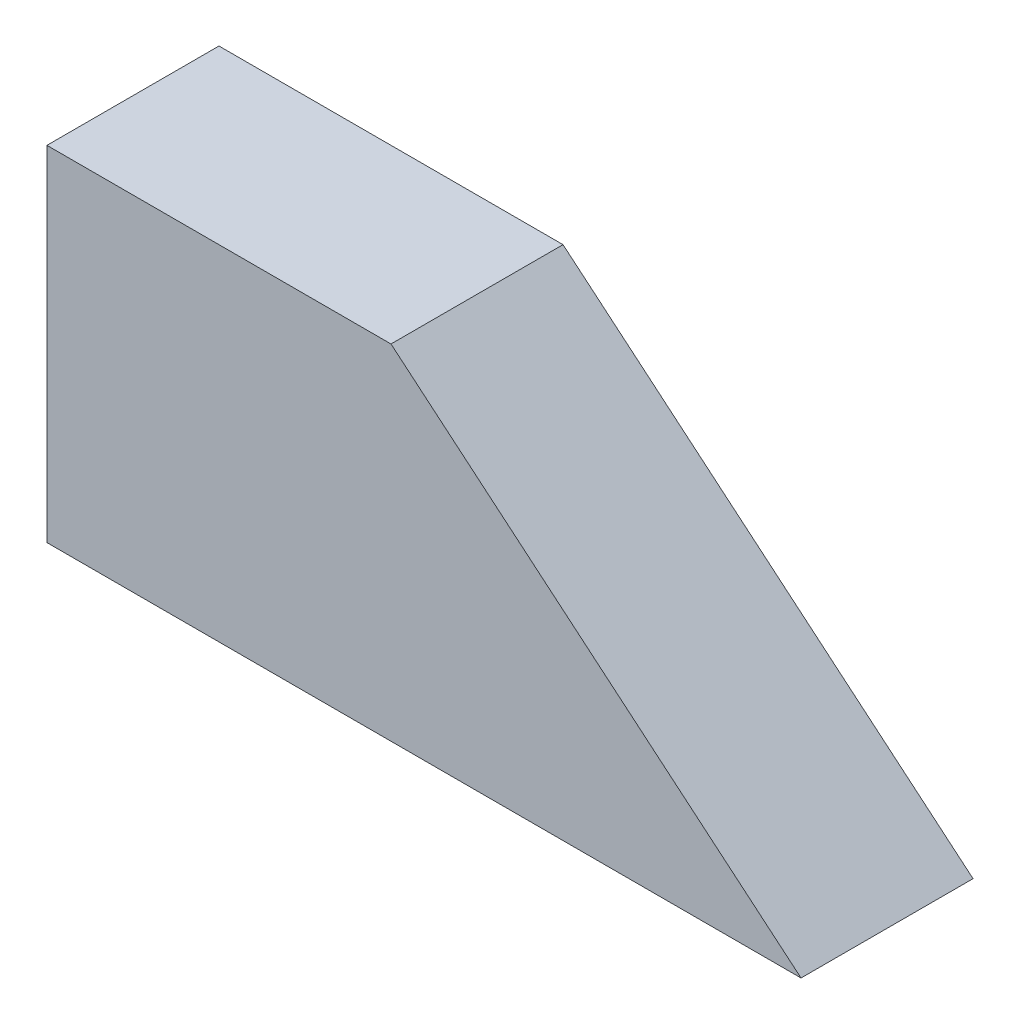
from build123d import *

# Parameters (mm, degrees)
BOSS_EXTRUDE1_DEPTH = 500


with BuildPart() as part:
    # Sketch1 → Boss-Extrude1 (new body)
    with BuildSketch(Plane.XY):
        Polygon((1000, 1000), (2191.753592594, 0), (138.559356058, 0), (0, 0), (0, 1000), align=None)
    extrude(amount=BOSS_EXTRUDE1_DEPTH)


solid = part.part
